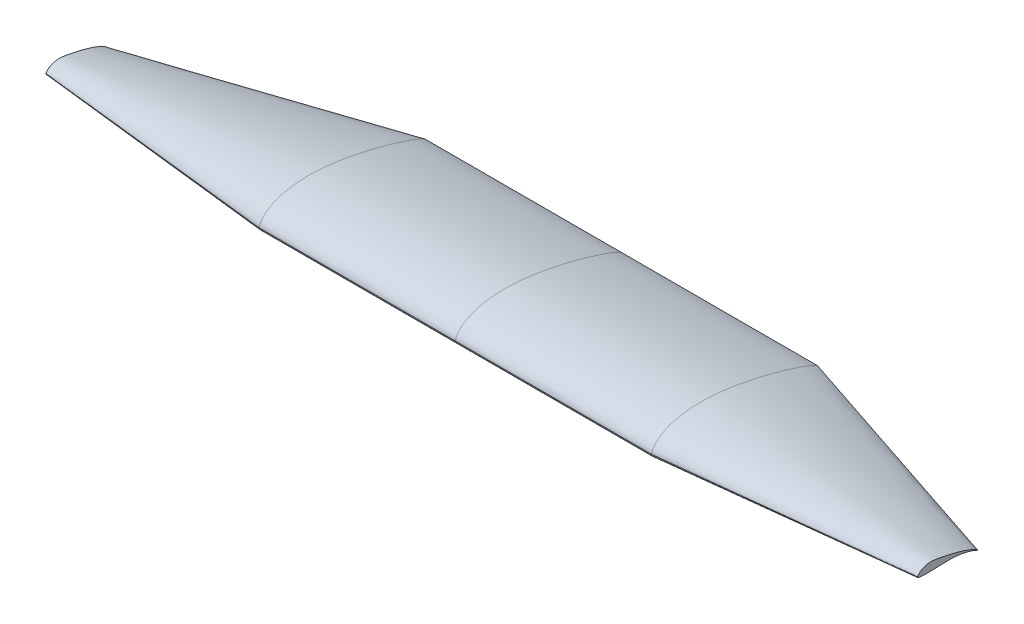
from build123d import *

# Parameters (mm, degrees)
BOSS_EXTRUDE2_DEPTH = 680.085


with BuildPart() as part:
    # Sketch2 → Boss-Extrude2 (new body)
    with BuildSketch(Plane(origin=(0, 0, 0), x_dir=(0, 0, -1), z_dir=(1, 0, 0))):
        with BuildLine():
            add(Edge.make_bspline(
                [(0, 0), (0.184350178, -1.886029359), (0.57327921, -5.865041366), (6.787457207, -9.929595436), (15.204614907, -12.635212475), (26.902808581, -15.274599622), (41.437180271, -17.31022823), (58.685955234, -18.895996189), (78.416937346, -19.883999358), (100.486283328, -20.065062678), (124.765204254, -19.435139833), (151.166287123, -17.998857828), (179.563199937, -15.852034483), (209.773816108, -13.279054846), (241.509368354, -10.538295088), (274.391005677, -7.852107465), (307.982974665, -5.428113542), (341.805502094, -3.475793858), (375.33213167, -2.158964139), (408.003596015, -1.606028544), (439.242999663, -1.886627845), (468.463925995, -3.027275925), (495.095214181, -4.976807821), (518.590082794, -7.599114185), (538.402412275, -10.740693302), (553.978219092, -14.189213148), (564.960793272, -17.40251406), (571.397498638, -19.595297254), (574.189748795, -20.625006215), (574.8782, -20.878889047)],
                knots=[0, 0, 0, 0, 0.00927919, 0.019576583, 0.035038705, 0.055494682, 0.080743463, 0.110497545, 0.144404004, 0.182202874, 0.22383069, 0.269139025, 0.318000586, 0.370105479, 0.424880898, 0.481620567, 0.539567058, 0.597874369, 0.655635141, 0.711901162, 0.76570278, 0.816085464, 0.862086075, 0.902833961, 0.937484878, 0.96507828, 0.984713227, 0.996230926, 1, 1, 1, 1], degree=3))
            add(Edge.make_bspline(
                [(574.8782, -20.878889047), (574.255604968, -20.567891325), (571.899786147, -19.391116299), (567.047969342, -16.711834531), (559.512973942, -12.590577321), (549.271852913, -7.838397095), (536.326006794, -2.753242676), (520.769264481, 2.813779532), (502.775008387, 8.867989073), (482.577131024, 15.268741114), (460.448468442, 21.916582303), (436.667824837, 28.686258319), (411.519770574, 35.421214136), (385.301484163, 41.990920435), (358.303344733, 48.249695792), (330.814678456, 54.054856194), (303.118564188, 59.266232787), (275.496008648, 63.771461599), (248.211981103, 67.443400172), (221.528776576, 70.193091418), (195.677618884, 71.929061337), (170.857352863, 72.512900256), (147.24217449, 71.944292327), (124.987582818, 70.211129818), (104.239425016, 67.325719403), (85.125816716, 63.343866282), (67.759356816, 58.342490365), (52.227707892, 52.439108149), (38.621289067, 45.739592537), (26.988147851, 38.421609104), (17.391063205, 30.662168239), (9.811131647, 22.711959181), (4.384583786, 14.81659771), (0.800023802, 7.296971506), (0.250127177, 2.28139573), (0, 0)],
                knots=[0, 0, 0, 0, 0.003392197, 0.012835633, 0.027011507, 0.04524908, 0.067819333, 0.09478818, 0.125784053, 0.16035825, 0.198063299, 0.238408408, 0.280877475, 0.324961706, 0.370154024, 0.415961685, 0.461900154, 0.50751525, 0.552371201, 0.596075191, 0.638247734, 0.678632813, 0.717052409, 0.753344587, 0.787381869, 0.819093435, 0.848433501, 0.87538514, 0.899979901, 0.922244207, 0.942232137, 0.960008565, 0.975548501, 0.988877938, 1, 1, 1, 1], degree=3))
        make_face()
    extrude(amount=BOSS_EXTRUDE2_DEPTH)


with BuildPart() as body_2:
    # Sketch5 → Loft1 section 0
    with BuildSketch(Plane(origin=(1511.3, 0, 0), x_dir=(0, 0, -1), z_dir=(1, 0, 0))):
        with BuildLine():
            add(Edge.make_bspline(
                [(300.50105, -23.654374778), (300.095829045, -23.241319472), (299.100169866, -22.226410687), (297.513521316, -20.513220795), (295.404159253, -18.70196758), (292.825833519, -16.951563439), (289.716350861, -15.152867764), (286.00150634, -13.225181494), (281.649845956, -11.162713813), (276.711660246, -8.993052491), (271.301167935, -6.760703352), (265.558179997, -4.513243739), (259.609519747, -2.293604082), (253.550296045, -0.134149428), (247.43887907, 1.94047764), (241.302022132, 3.914824642), (235.141317812, 5.78143807), (228.941694824, 7.542155415), (222.677927948, 9.203914483), (216.321055413, 10.780650968), (209.8449054, 12.289053433), (203.235573996, 13.750448244), (196.500147854, 15.184020581), (189.673028859, 16.602944696), (182.816706586, 18.007356402), (176.015896548, 19.383057512), (169.368386413, 20.697121721), (162.978409028, 21.907430367), (156.938804201, 22.967941404), (151.296569747, 23.826411636), (146.036063212, 24.434740326), (141.099510436, 24.773177521), (136.422767675, 24.844146818), (131.956232873, 24.650830222), (127.668759534, 24.197780882), (123.544886892, 23.491616118), (119.583573532, 22.543940795), (115.799412973, 21.36799108), (112.22227176, 19.993516539), (108.898349969, 18.467689166), (105.880807712, 16.858909619), (103.215709831, 15.239907344), (100.921386957, 13.674850074), (98.988203913, 12.196963141), (97.382449689, 10.815535258), (96.059069265, 9.527274217), (94.970505452, 8.327329187), (94.075110024, 7.209644863), (93.340492398, 6.166231382), (92.742128613, 5.188716646), (92.262842088, 4.268063987), (91.892697287, 3.396833434), (91.614458071, 2.570399585), (91.509519705, 2.023817826), (91.45905, 1.760941422)],
                knots=[0, 0, 0, 0, 0.00766831, 0.01884163, 0.030923484, 0.044413382, 0.060081013, 0.078504588, 0.099860575, 0.123886262, 0.149974542, 0.177417159, 0.205607409, 0.234110695, 0.262656624, 0.291130441, 0.319536223, 0.347957807, 0.376531226, 0.405409704, 0.434747003, 0.464646563, 0.495109357, 0.526002241, 0.557051306, 0.587854355, 0.61795044, 0.646846901, 0.674037144, 0.699206718, 0.722466682, 0.744192546, 0.764750857, 0.784416734, 0.803401596, 0.821845654, 0.839822141, 0.857338225, 0.874319596, 0.890568919, 0.905774626, 0.919610214, 0.931872064, 0.942561588, 0.951840253, 0.959925311, 0.967020261, 0.973296392, 0.978891577, 0.98391932, 0.988474123, 0.992631669, 0.996456229, 1, 1, 1, 1], degree=3))
            add(Edge.make_bspline(
                [(91.45905, 1.760941422), (91.429250514, 1.508168703), (91.36957498, 1.001973836), (91.454033962, 0.227618223), (91.814154176, -0.494279001), (92.45912033, -1.032604571), (93.263982228, -1.414870804), (94.197183102, -1.71496492), (95.268437903, -1.968105115), (96.507646649, -2.197299317), (97.962995985, -2.416425503), (99.706609308, -2.629579534), (101.842154242, -2.840531192), (104.511820323, -3.049830667), (107.876944585, -3.254448142), (112.044761513, -3.446957129), (116.98798826, -3.600848051), (122.563999189, -3.66346637), (128.617594248, -3.588956457), (135.049333494, -3.390509067), (141.788275838, -3.121796106), (148.741390262, -2.818176293), (155.794098615, -2.500002898), (162.846275549, -2.187515547), (169.828990721, -1.901015779), (176.709767915, -1.65726466), (183.478933941, -1.474402629), (190.1372159, -1.366134696), (196.6899827, -1.347102094), (203.146537001, -1.42924773), (209.516501841, -1.62132643), (215.81027149, -1.932692113), (222.036391819, -2.368475485), (228.203565578, -2.935213268), (234.318340415, -3.636482546), (240.386386041, -4.475792841), (246.408570268, -5.453901961), (252.381381728, -6.571320813), (258.291325076, -7.824536195), (264.109951313, -9.208197095), (269.784409685, -10.704978351), (275.227766002, -12.292574565), (280.32438679, -13.931425591), (284.953598664, -15.579773213), (289.028787292, -17.205635904), (292.52595699, -18.791333478), (295.470496237, -20.337080291), (298.100038955, -21.907456703), (299.684982235, -23.060623437), (300.50105, -23.654374778)],
                knots=[0, 0, 0, 0, 0.003545446, 0.007100002, 0.010709605, 0.01449356, 0.01858, 0.023086043, 0.028144122, 0.033925766, 0.040660467, 0.048670742, 0.058425917, 0.070591998, 0.086022064, 0.105450899, 0.12878911, 0.155005386, 0.183229049, 0.213230315, 0.244761986, 0.277305163, 0.310311888, 0.343240557, 0.375772708, 0.407795702, 0.439280206, 0.470229073, 0.500682377, 0.530682148, 0.560294989, 0.589572618, 0.618575746, 0.647349376, 0.675954134, 0.704422528, 0.73279079, 0.761050556, 0.789174899, 0.817053577, 0.844469802, 0.871026901, 0.896137352, 0.91913773, 0.939557781, 0.957323593, 0.972672167, 0.985929235, 1, 1, 1, 1], degree=3))
        make_face()
    # Sketch6 → Loft1 section 1
    with BuildSketch(Plane(origin=(680.085, 0, 0), x_dir=(0, 0, -1), z_dir=(1, 0, 0))):
        with BuildLine():
            add(Edge.make_bspline(
                [(574.8782, -20.878889047), (574.255604968, -20.567891325), (571.899786147, -19.391116299), (567.047969342, -16.711834531), (559.512973942, -12.590577321), (549.271852913, -7.838397095), (536.326006794, -2.753242676), (520.769264481, 2.813779532), (502.775008387, 8.867989073), (482.577131024, 15.268741114), (460.448468442, 21.916582303), (436.667824837, 28.686258319), (411.519770574, 35.421214136), (385.301484163, 41.990920435), (358.303344733, 48.249695792), (330.814678456, 54.054856194), (303.118564188, 59.266232787), (275.496008648, 63.771461599), (248.211981103, 67.443400172), (221.528776576, 70.193091418), (195.677618884, 71.929061337), (170.857352863, 72.512900256), (147.24217449, 71.944292327), (124.987582818, 70.211129818), (104.239425016, 67.325719403), (85.125816716, 63.343866282), (67.759356816, 58.342490365), (52.227707892, 52.439108149), (38.621289067, 45.739592537), (26.988147851, 38.421609104), (17.391063205, 30.662168239), (9.811131647, 22.711959181), (4.384583786, 14.81659771), (0.800023802, 7.296971506), (0.250127177, 2.28139573), (0, 0)],
                knots=[0, 0, 0, 0, 0.003392197, 0.012835633, 0.027011507, 0.04524908, 0.067819333, 0.09478818, 0.125784053, 0.16035825, 0.198063299, 0.238408408, 0.280877475, 0.324961706, 0.370154024, 0.415961685, 0.461900154, 0.50751525, 0.552371201, 0.596075191, 0.638247734, 0.678632813, 0.717052409, 0.753344587, 0.787381869, 0.819093435, 0.848433501, 0.87538514, 0.899979901, 0.922244207, 0.942232137, 0.960008565, 0.975548501, 0.988877938, 1, 1, 1, 1], degree=3))
            add(Edge.make_bspline(
                [(0, 0), (0.184350178, -1.886029359), (0.57327921, -5.865041366), (6.787457207, -9.929595436), (15.204614907, -12.635212475), (26.902808581, -15.274599622), (41.437180271, -17.31022823), (58.685955234, -18.895996189), (78.416937346, -19.883999358), (100.486283328, -20.065062678), (124.765204254, -19.435139833), (151.166287123, -17.998857828), (179.563199937, -15.852034483), (209.773816108, -13.279054846), (241.509368354, -10.538295088), (274.391005677, -7.852107465), (307.982974665, -5.428113542), (341.805502094, -3.475793858), (375.33213167, -2.158964139), (408.003596015, -1.606028544), (439.242999663, -1.886627845), (468.463925995, -3.027275925), (495.095214181, -4.976807821), (518.590082794, -7.599114185), (538.402412275, -10.740693302), (553.978219092, -14.189213148), (564.960793272, -17.40251406), (571.397498638, -19.595297254), (574.189748795, -20.625006215), (574.8782, -20.878889047)],
                knots=[0, 0, 0, 0, 0.00927919, 0.019576583, 0.035038705, 0.055494682, 0.080743463, 0.110497545, 0.144404004, 0.182202874, 0.22383069, 0.269139025, 0.318000586, 0.370105479, 0.424880898, 0.481620567, 0.539567058, 0.597874369, 0.655635141, 0.711901162, 0.76570278, 0.816085464, 0.862086075, 0.902833961, 0.937484878, 0.96507828, 0.984713227, 0.996230926, 1, 1, 1, 1], degree=3))
        make_face()
    loft()


with BuildPart() as body_3:
    # Mirror1: mirrored copy
    add(part.part.mirror(Plane(origin=(0, 0, 0), x_dir=(0, 0, 1), z_dir=(1, 0, 0))))


with BuildPart() as body_4:
    # Mirror1 2: mirrored copy
    add(body_2.part.mirror(Plane(origin=(0, 0, 0), x_dir=(0, 0, 1), z_dir=(1, 0, 0))))


solid = Compound([part.part, body_2.part, body_3.part, body_4.part])
